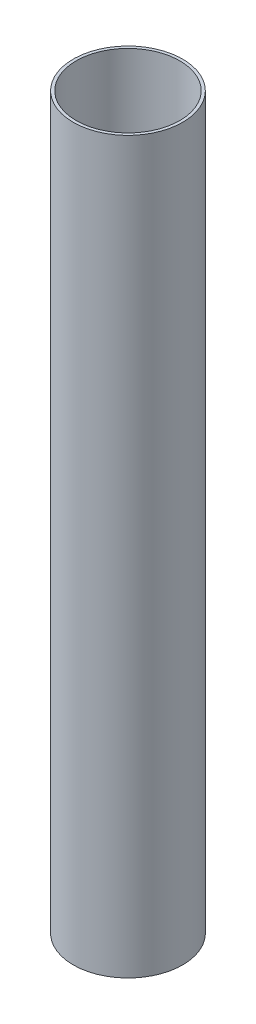
from build123d import *

# Parameters (mm, degrees)
SKETCH1_R           = 37.5
SKETCH1_R_2         = 35.5
BOSS_EXTRUDE1_DEPTH = 500


with BuildPart() as part:
    # Sketch1 → Boss-Extrude1 (new body)
    with BuildSketch(Plane(origin=(0, 0, 0), x_dir=(1, 0, 0), z_dir=(0, 1, 0))):
        Circle(SKETCH1_R)
        Circle(SKETCH1_R_2, mode=Mode.SUBTRACT)
    extrude(amount=BOSS_EXTRUDE1_DEPTH)


solid = part.part
